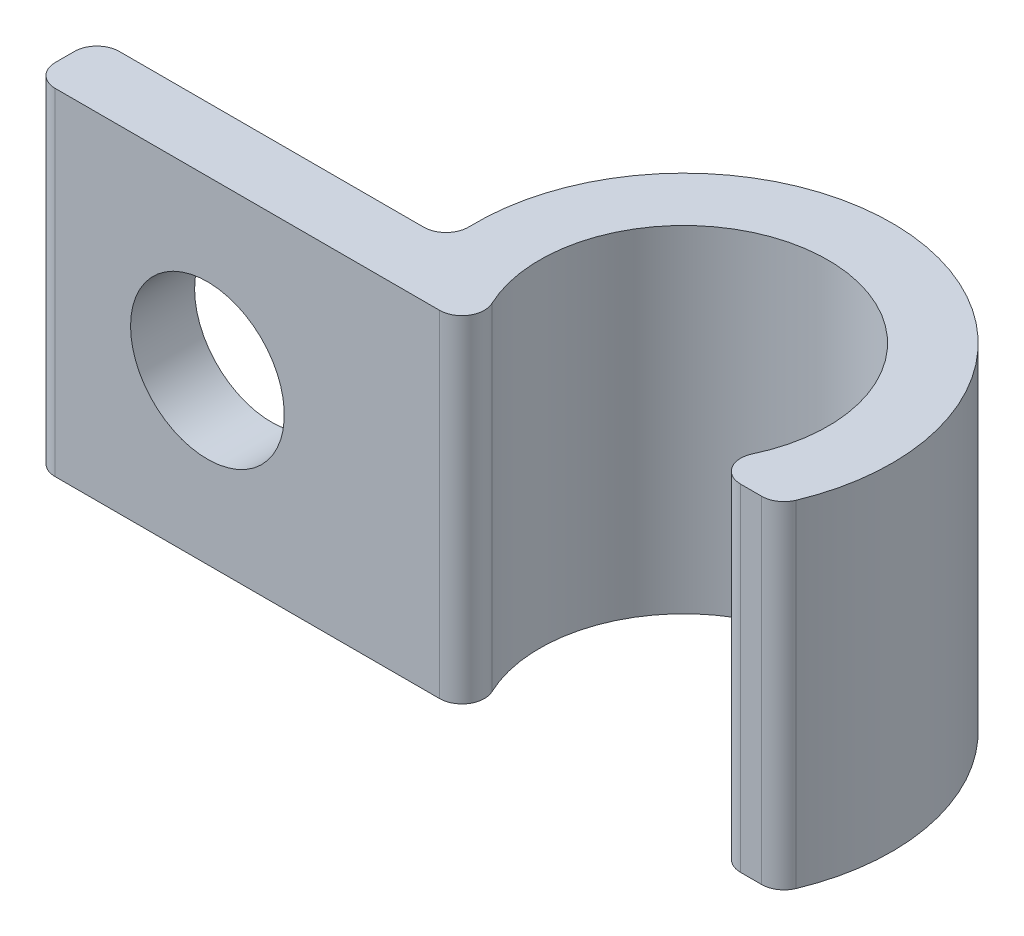
from build123d import *

# Parameters (mm, degrees)
BOSS_EXTRU_1_DEPTH = 10.5
D_GAGEMENT_M41_D   = 4.8


with BuildPart() as part:
    # Esquisse1 → Boss.-Extru.1 (new body)
    with BuildSketch(Plane(origin=(0, 0, 0), x_dir=(1, 0, 0), z_dir=(0, 1, 0))):
        with BuildLine():
            Line((0, 0), (12, 0))
            ThreePointArc((12, 0), (12.591460154, 0.325600632), (12.632692308, 0.999500324))
            ThreePointArc((12.632692308, 0.999500324), (16.7, 7.424859546), (20.767307692, 0.999500324))
            ThreePointArc((20.767307692, 0.999500324), (20.808539846, 0.325600632), (21.4, 0))
            Line((21.4, 0), (22.056304696, 0))
            ThreePointArc((22.056304696, 0), (22.444916153, 0.117779135), (22.702755263, 0.431482469))
            ThreePointArc((22.702755263, 0.431482469), (17.871531541, 9.318412068), (10.20317064, 2.721861345))
            ThreePointArc((10.20317064, 2.721861345), (10.006156571, 2.212815713), (9.503512094, 2))
            Line((9.503512094, 2), (0, 2))
            ThreePointArc((0, 2), (-0.494974747, 1.794974747), (-0.7, 1.3))
            Line((-0.7, 1.3), (-0.7, 0.7))
            ThreePointArc((-0.7, 0.7), (-0.494974747, 0.205025253), (0, 0))
        make_face()
    extrude(amount=BOSS_EXTRU_1_DEPTH)

    # Dégagement M41 (through all)
    with Locations(Plane(origin=(0, 0, -2), x_dir=(-1, 0, 0), z_dir=(0, 0, -1))):
        with Locations((-4.751756047, 5.25)):
            Hole(D_GAGEMENT_M41_D / 2)


solid = part.part
